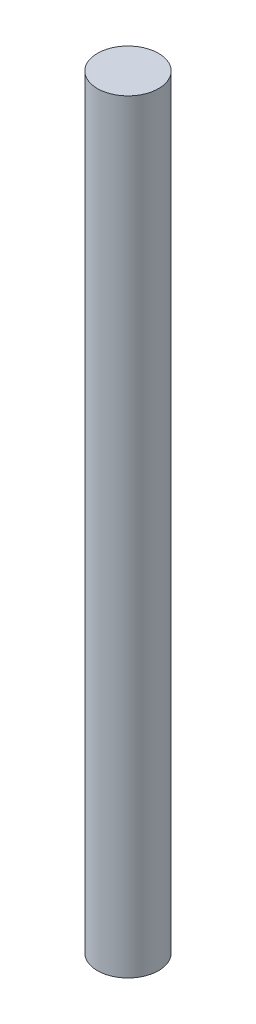
from build123d import *

# Parameters (mm, degrees)
SKETCH1_R           = 30
BOSS_EXTRUDE1_DEPTH = 750


with BuildPart() as part:
    # Sketch1 → Boss-Extrude1 (new body)
    with BuildSketch(Plane(origin=(0, 0, 0), x_dir=(1, 0, 0), z_dir=(0, 1, 0))):
        with Locations(Location((0, 0, 0), (0, 0, 270))):
            Circle(SKETCH1_R)
    extrude(amount=BOSS_EXTRUDE1_DEPTH)


solid = part.part
